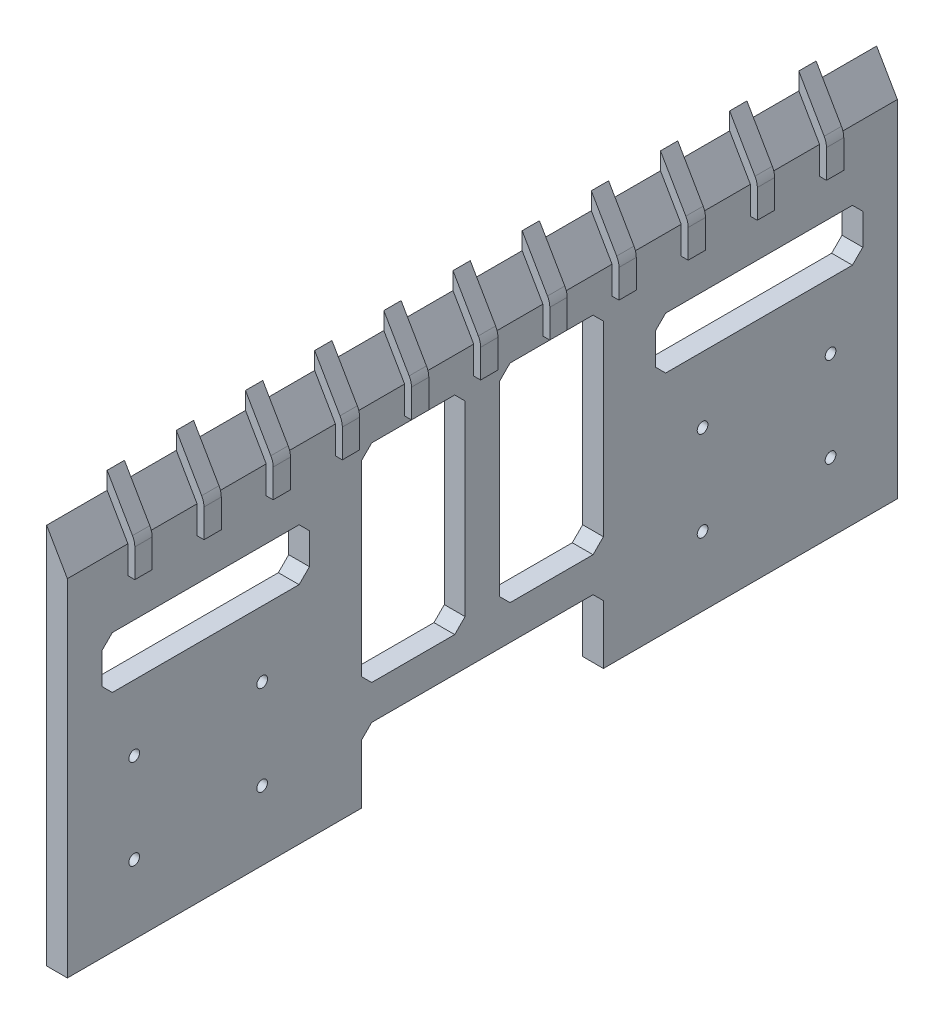
from build123d import *

# Parameters (mm, degrees)
SKETCH_1_W                 = 240
SKETCH_1_H                 = 100
EXTRUDE_1_DEPTH            = 6
SKETCH_2_R                 = 1.55
CUT_EXTRUDE_1_DEPTH        = 261.069221555
SKETCH_3_W                 = 60
SKETCH_3_H                 = 15
CUT_EXTRUDE_2_DEPTH        = 261.069221555
SKETCH_4_W                 = 30
SKETCH_4_H                 = 60
CUT_EXTRUDE_3_DEPTH        = 261.069221555
SKETCH_5_R                 = 3
CUT_EXTRUDE_4_DEPTH        = 3
EXTRUDE_2_DEPTH            = 240
EXTRUDE_3_DEPTH            = 5
PATTERN_LINEAR_5_COUNT     = 6
PATTERN_LINEAR_5_PITCH     = 20
PATTERN_LINEAR_5_COL_COUNT = 6
PATTERN_LINEAR_5_COL_PITCH = 20
FILLET_5_R                 = 5
CHAMFER_1_SIZE             = 3
CUT_EXTRUDE_7_DEPTH        = 261.069221555


with BuildPart() as part:
    # 草图1 → 凸台-拉伸1 (new body)
    with BuildSketch(Plane(origin=(0, 0, 0), x_dir=(0, 0, -1), z_dir=(1, 0, 0))):
        with Locations((120, -50)):
            Rectangle(SKETCH_1_W, SKETCH_1_H)
    extrude(amount=EXTRUDE_1_DEPTH)

    # 草图2 → 切除-拉伸1 (cut, through all)
    with BuildSketch(Plane(origin=(6, 0, 0), x_dir=(0, 0, -1), z_dir=(1, 0, 0))):
        with Locations((19.32352941, -54)):
            Circle(SKETCH_2_R)
        with Locations((56.32352941, -80)):
            Circle(SKETCH_2_R)
        with Locations((56.32352941, -54)):
            Circle(SKETCH_2_R)
        with Locations((19.32352941, -80)):
            Circle(SKETCH_2_R)
        with Locations(Location((220.67647059, -80, 0), (0, 0, 180))):
            Circle(SKETCH_2_R)
        with Locations(Location((183.67647059, -54, 0), (0, 0, 180))):
            Circle(SKETCH_2_R)
        with Locations(Location((183.67647059, -80, 0), (0, 0, 180))):
            Circle(SKETCH_2_R)
        with Locations(Location((220.67647059, -54, 0), (0, 0, 180))):
            Circle(SKETCH_2_R)
    extrude(amount=-CUT_EXTRUDE_1_DEPTH, mode=Mode.SUBTRACT)

    # 草图3 → 切除-拉伸2 (cut, through all)
    with BuildSketch(Plane(origin=(6, 0, 0), x_dir=(0, 0, -1), z_dir=(1, 0, 0))):
        with Locations((40, -27.5)):
            Rectangle(SKETCH_3_W, SKETCH_3_H)
        with Locations((200, -27.5)):
            Rectangle(SKETCH_3_W, SKETCH_3_H)
    extrude(amount=-CUT_EXTRUDE_2_DEPTH, mode=Mode.SUBTRACT)

    # 草图4 → 切除-拉伸3 (cut, through all)
    with BuildSketch(Plane(origin=(6, 0, 0), x_dir=(0, 0, -1), z_dir=(1, 0, 0))):
        with Locations((100, -40)):
            Rectangle(SKETCH_4_W, SKETCH_4_H)
        with Locations((140, -40)):
            Rectangle(SKETCH_4_W, SKETCH_4_H)
    extrude(amount=-CUT_EXTRUDE_3_DEPTH, mode=Mode.SUBTRACT)

    # 草图5 → 切除-拉伸4 (cut)
    with BuildSketch(Plane.ZY):
        with Locations((-183.67647059, -80)):
            Circle(SKETCH_5_R)
        with Locations((-220.67647059, -80)):
            Circle(SKETCH_5_R)
        with Locations((-183.67647059, -54)):
            Circle(SKETCH_5_R)
        with Locations((-220.67647059, -54)):
            Circle(SKETCH_5_R)
        with Locations((-45, -80)):
            Circle(SKETCH_5_R)
        with Locations((-19.32352941, -80)):
            Circle(SKETCH_5_R)
        with Locations((-19.32352941, -54)):
            Circle(SKETCH_5_R)
        with Locations((-56.32352941, -54)):
            Circle(SKETCH_5_R)
    extrude(amount=-CUT_EXTRUDE_4_DEPTH, mode=Mode.SUBTRACT)

    # 草图6 → 凸台-拉伸2 (add)
    with BuildSketch(Plane.XY):
        Polygon((6, 0), (0, 0), (0, 10.392304845), align=None)
    extrude(amount=-EXTRUDE_2_DEPTH)

    # 草图7 → 凸台-拉伸3 (add)
    with BuildSketch(Plane.XY.offset(-117.5)):
        Polygon((0, 10.392304845), (0, 15.392304845), (8, 1.535898385), (8, -8), (6, -8), (6, 0), align=None)
    extrude_3 = extrude(amount=-EXTRUDE_3_DEPTH)

    # 阵列(线性)5: 凸台-拉伸3 ×6
    with Locations(*[(0, 0, i * PATTERN_LINEAR_5_PITCH) for i in range(1, PATTERN_LINEAR_5_COUNT)]):
        add(extrude_3)

    # 阵列(线性)5 col: 凸台-拉伸3 ×6
    with Locations(*[(0, 0, -i * PATTERN_LINEAR_5_COL_PITCH) for i in range(1, PATTERN_LINEAR_5_COL_COUNT)]):
        add(extrude_3)

    # 圆角5
    fillet_5_edges = [part.edges().sort_by_distance(p)[0] for p in [
        (8, 1.535898385, -120),
        (8, 1.535898385, -140),
        (8, 1.535898385, -160),
        (8, 1.535898385, -180),
        (8, 1.535898385, -200),
        (8, 1.535898385, -220),
        (8, 1.535898385, -100),
        (8, 1.535898385, -80),
        (8, 1.535898385, -60),
        (8, 1.535898385, -40),
        (8, 1.535898385, -20),
    ]]
    fillet(fillet_5_edges, radius=FILLET_5_R)

    # 倒角1
    chamfer_1_edges = [part.edges().sort_by_distance(p)[0] for p in [
        (3, -35, -10),
        (3, -20, -10),
        (3, -20, -70),
        (3, -35, -70),
        (3, -20, -170),
        (3, -20, -230),
        (3, -35, -230),
        (3, -35, -170),
        (3, -10, -115),
        (3, -70, -115),
        (3, -70, -85),
        (3, -10, -85),
        (3, -10, -125),
        (3, -10, -155),
        (3, -70, -155),
        (3, -70, -125),
    ]]
    chamfer(chamfer_1_edges, length=CHAMFER_1_SIZE)

    # 草图8 → 切除-拉伸7 (cut, through all)
    with BuildSketch(Plane(origin=(6, 0, 0), x_dir=(0, 0, -1), z_dir=(1, 0, 0))):
        Polygon((85, -100), (85, -83), (88, -80), (152, -80), (155, -83), (155, -100), align=None)
    extrude(amount=-CUT_EXTRUDE_7_DEPTH, mode=Mode.SUBTRACT)


solid = part.part
